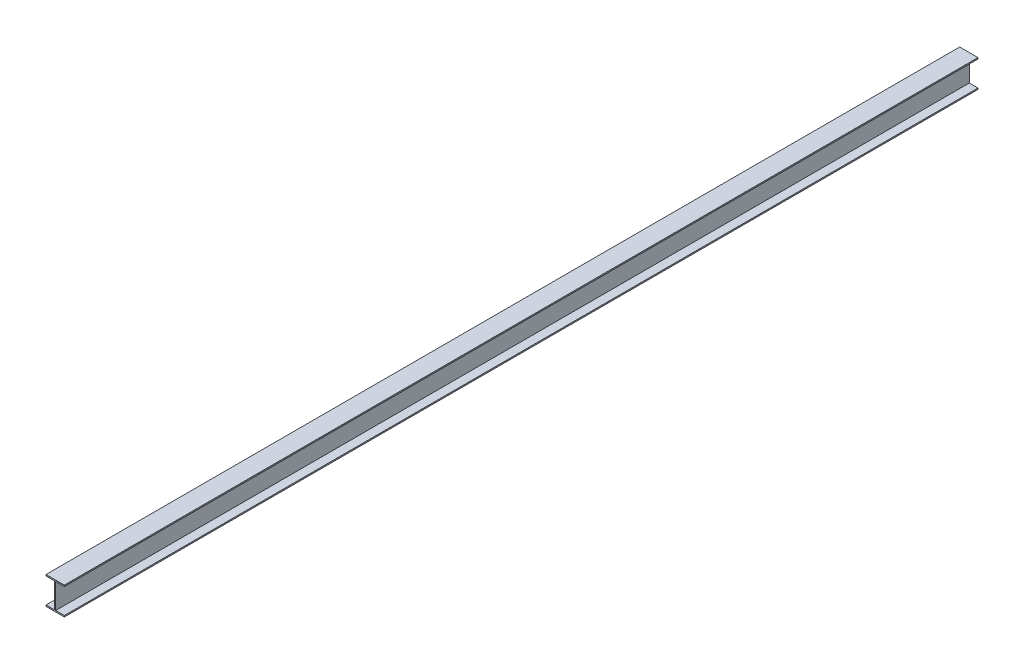
from build123d import *

# Parameters (mm, degrees)
BOSS_EXTRUDE1_DEPTH = 3510
BOSS_EXTRUDE2_DEPTH = 777.168091258
BOSS_EXTRUDE3_DEPTH = 774.831908742


with BuildPart() as part:
    # Sketch1 → Boss-Extrude1 (new body)
    with BuildSketch(Plane.XY):
        Polygon((0, -0.000240533), (101.6, -0.000240533), (101.6, -7.112240533), (53.408035714, -7.112240533), (53.408035714, -146.050240533), (101.6, -146.050240533), (101.6, -153.162240533), (0, -153.162240533), (0, -146.050240533), (47.566035714, -146.050240533), (47.566035714, -7.112240533), (0, -7.112240533), align=None)
    extrude(amount=BOSS_EXTRUDE1_DEPTH)

    # Sketch3 → Boss-Extrude2 (add)
    with BuildSketch(Plane.XY.offset(3510)):
        Polygon((0, -0.000240533), (0, -7.112240533), (47.566035714, -7.112240533), (47.566035714, -146.050240533), (0, -146.050240533), (0, -153.162240533), (101.6, -153.162240533), (101.6, -146.050240533), (53.408035714, -146.050240533), (53.408035714, -7.112240533), (101.6, -7.112240533), (101.6, -0.000240533), align=None)
    extrude(amount=BOSS_EXTRUDE2_DEPTH)

    # Sketch4 → Boss-Extrude3 (add)
    with BuildSketch(Plane(origin=(0, 0, 0), x_dir=(-1, 0, 0), z_dir=(0, 0, -1))):
        Polygon((0, -7.112240533), (0, -0.000240533), (-101.6, -0.000240533), (-101.6, -7.112240533), (-53.408035714, -7.112240533), (-53.408035714, -146.050240533), (-101.6, -146.050240533), (-101.6, -153.162240533), (0, -153.162240533), (0, -146.050240533), (-47.566035714, -146.050240533), (-47.566035714, -7.112240533), align=None)
    extrude(amount=BOSS_EXTRUDE3_DEPTH)


solid = part.part
